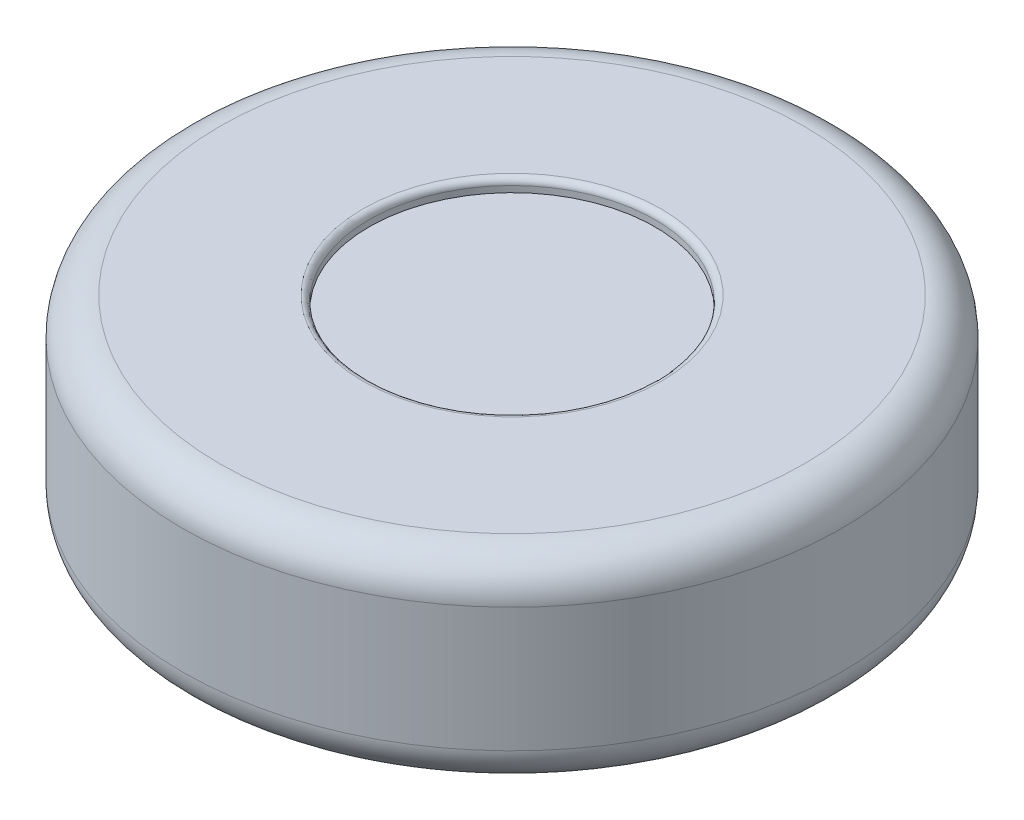
from build123d import *

# Parameters (mm, degrees)
CROQUIS1_R                   = 115
SALIENTE_EXTRUIR1_DEPTH      = 140
SALIENTE_EXTRUIR2_DEPTH      = 80
SALIENTE_EXTRUIR2_DEPTH_BACK = 80
CROQUIS2_R                   = 265
CROQUIS2_R_2                 = 115
REDONDEO1_R                  = 30
REDONDEO2_R                  = 5
REDONDEO3_R                  = 5


with BuildPart() as part:
    # Croquis1 → Saliente-Extruir1 (new body)
    with BuildSketch(Plane(origin=(0, 0, 0), x_dir=(1, 0, 0), z_dir=(0, 1, 0))):
        with Locations(Location((0, 0, 0), (0, 0, 270))):
            Circle(CROQUIS1_R)
    extrude(amount=SALIENTE_EXTRUIR1_DEPTH)

    # Croquis2 → Saliente-Extruir2 (add, two sides: drawn at the far end of the back side and taken through both)
    with BuildSketch(Plane(origin=(0, 70, 0), x_dir=(1, 0, 0), z_dir=(0, 1, 0)).offset(-SALIENTE_EXTRUIR2_DEPTH_BACK)):
        with Locations(Location((0, 0, 0), (0, 0, 270))):
            Circle(CROQUIS2_R)
        with Locations(Location((0, 0, 0), (0, 0, 270))):
            Circle(CROQUIS2_R_2, mode=Mode.SUBTRACT)
    extrude(amount=SALIENTE_EXTRUIR2_DEPTH + SALIENTE_EXTRUIR2_DEPTH_BACK)

    # Redondeo1
    redondeo1_edges = [part.edges().sort_by_distance(p)[0] for p in [
        (0, -10, -265),
        (0, 150, -265),
    ]]
    fillet(redondeo1_edges, radius=REDONDEO1_R)

    # Redondeo2
    redondeo2_edges = [part.edges().sort_by_distance(p)[0] for p in [
        (0, -10, -115),
    ]]
    fillet(redondeo2_edges, radius=REDONDEO2_R)

    # Redondeo3
    redondeo3_edges = [part.edges().sort_by_distance(p)[0] for p in [
        (0, 150, -115),
    ]]
    fillet(redondeo3_edges, radius=REDONDEO3_R)


solid = part.part
